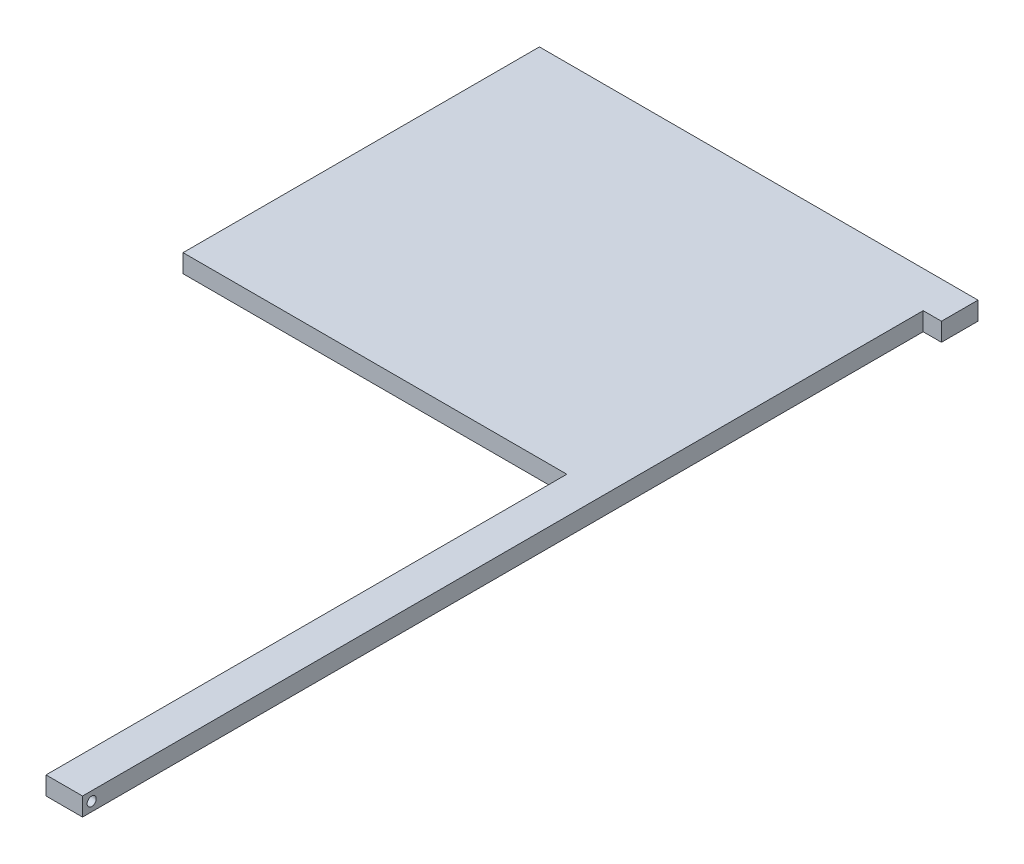
from build123d import *

# Parameters (mm, degrees)
SKETCH1_W           = 482.6
SKETCH1_H           = 304.8
BOSS_EXTRUDE1_DEPTH = 12.7
BOSS_EXTRUDE2_DEPTH = 6.35
SKETCH3_R           = 1.5875
CUT_EXTRUDE1_DEPTH  = 507.449822292
SKETCH4_W           = 6.35
SKETCH4_H           = 12.7
BOSS_EXTRUDE3_DEPTH = 292.1
SKETCH5_W           = 12.7
SKETCH5_H           = 19.05
BOSS_EXTRUDE4_DEPTH = 6.35
CUT_EXTRUDE2_START  = 6.35
CUT_EXTRUDE2_DEPTH  = 25.4
CUT_EXTRUDE3_START  = -488.95
CUT_EXTRUDE3_DEPTH  = 25.4
BOSS_EXTRUDE5_START = -2.54
BOSS_EXTRUDE5_DEPTH = 7.62
SKETCH13_W          = 304.8
SKETCH13_H          = 12.7
CUT_EXTRUDE4_DEPTH  = 519.566054134
SKETCH17_W          = 369.208963073
SKETCH17_H          = 308.023191689
CUT_EXTRUDE7_DEPTH  = 291.854955261


with BuildPart() as part:
    # Sketch1 → Boss-Extrude1 (new body)
    with BuildSketch(Plane(origin=(0, 0, 0), x_dir=(1, 0, 0), z_dir=(0, 1, 0))):
        Rectangle(SKETCH1_W, SKETCH1_H)
    extrude(amount=BOSS_EXTRUDE1_DEPTH)

    # Sketch2 → Boss-Extrude2 (add)
    with BuildSketch(Plane(origin=(0, 12.7, 0), x_dir=(1, 0, 0), z_dir=(0, 1, 0))):
        Polygon((-241.3, 152.4), (-228.6, 152.4), (228.6, 152.4), (241.3, 152.4), (241.3, -152.4), (228.6, -152.4), (228.6, 28.575), (-228.6, 28.575), (-228.6, -152.4), (-241.3, -152.4), align=None)
    extrude(amount=BOSS_EXTRUDE2_DEPTH)

    # Sketch3 → Cut-Extrude1 (cut, through all)
    with BuildSketch(Plane.ZY.offset(241.3)):
        with Locations((149.225, 15.875)):
            Circle(SKETCH3_R)
    extrude(amount=-CUT_EXTRUDE1_DEPTH, mode=Mode.SUBTRACT)

    # Sketch4 → Boss-Extrude3 (add)
    with BuildSketch(Plane.XY.offset(152.4)):
        with Locations((-244.475, 6.35)):
            Rectangle(SKETCH4_W, SKETCH4_H)
    boss_extrude3 = extrude(amount=-BOSS_EXTRUDE3_DEPTH)

    # Sketch5 → Boss-Extrude4 (add)
    with BuildSketch(Plane.ZY.offset(241.3)):
        with Locations((-146.05, 9.525)):
            Rectangle(SKETCH5_W, SKETCH5_H)
    boss_extrude4 = extrude(amount=BOSS_EXTRUDE4_DEPTH)

    # Mirror1: Boss-Extrude3, Boss-Extrude4 across plane
    add(boss_extrude3.mirror(Plane(origin=(0, 0, 0), x_dir=(0, 0, 1), z_dir=(1, 0, 0))))
    add(boss_extrude4.mirror(Plane(origin=(0, 0, 0), x_dir=(0, 0, 1), z_dir=(1, 0, 0))))

    # Sketch6 → Cut-Extrude2 (cut)
    with BuildSketch(Plane.ZY.offset(241.3).offset(CUT_EXTRUDE2_START)):
        with BuildLine():
            Line((147.32, 2.54), (128.27, 2.54))
            ThreePointArc((128.27, 2.54), (124.46, 6.35), (128.27, 10.16))
            Line((128.27, 10.16), (147.32, 10.16))
            ThreePointArc((147.32, 10.16), (151.13, 6.35), (147.32, 2.54))
        make_face()
    extrude(amount=-CUT_EXTRUDE2_DEPTH, mode=Mode.SUBTRACT)

    # Sketch6<2> → Cut-Extrude3 (cut)
    with BuildSketch(Plane.ZY.offset(241.3).offset(CUT_EXTRUDE3_START)):
        with BuildLine():
            Line((147.32, 2.54), (128.27, 2.54))
            ThreePointArc((128.27, 2.54), (124.46, 6.35), (128.27, 10.16))
            Line((128.27, 10.16), (147.32, 10.16))
            ThreePointArc((147.32, 10.16), (151.13, 6.35), (147.32, 2.54))
        make_face()
    extrude(amount=CUT_EXTRUDE3_DEPTH, mode=Mode.SUBTRACT)

    # Sketch11 → Boss-Extrude5 (add)
    with BuildSketch(Plane.XZ.offset(BOSS_EXTRUDE5_START)):
        Polygon((-247.65, 124.46), (-222.25, 124.46), (-222.25, 140.97), align=None)
    boss_extrude5 = extrude(amount=-BOSS_EXTRUDE5_DEPTH)

    # Mirror2: Boss-Extrude5 across plane
    add(boss_extrude5.mirror(Plane(origin=(0, 0, 0), x_dir=(0, 0, 1), z_dir=(1, 0, 0))))

    # Sketch13 → Cut-Extrude4 (cut, through all)
    with BuildSketch(Plane.ZY.offset(247.65)):
        with Locations((0, 6.35)):
            Rectangle(SKETCH13_W, SKETCH13_H)
    extrude(amount=-CUT_EXTRUDE4_DEPTH, mode=Mode.SUBTRACT)

    # Sketch17 → Cut-Extrude7 (cut, through all)
    with BuildSketch(Plane(origin=(0, 19.05, 0), x_dir=(1, 0, 0), z_dir=(0, 1, 0))):
        with Locations((-89.354481537, -1.611595845)):
            Rectangle(SKETCH17_W, SKETCH17_H)
    extrude(amount=-CUT_EXTRUDE7_DEPTH, mode=Mode.SUBTRACT)


solid = part.part
